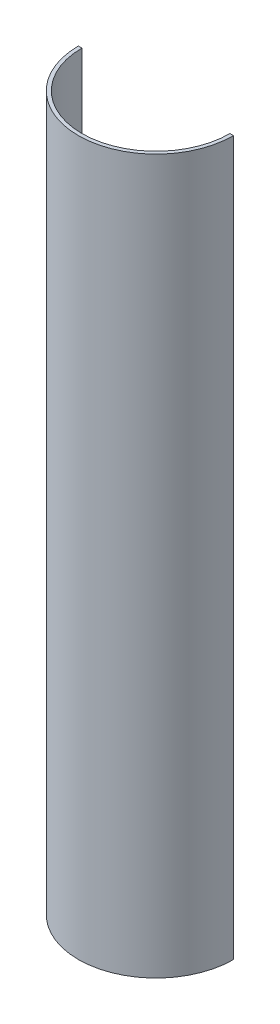
from build123d import *

# Parameters (mm, degrees)
BOSS_EXTRUDE1_DEPTH = 400


with BuildPart() as part:
    # Sketch1 → Boss-Extrude1 (new body)
    with BuildSketch(Plane(origin=(0, 0, 0), x_dir=(1, 0, 0), z_dir=(0, 1, 0))):
        with BuildLine():
            Line((84, 0), (86, 0))
            ThreePointArc((86, 0), (42.5, -43.5), (-1, 0))
            Line((-1, 0), (1, 0))
            ThreePointArc((1, 0), (42.5, -41.5), (84, 0))
        make_face()
    extrude(amount=BOSS_EXTRUDE1_DEPTH)


solid = part.part
